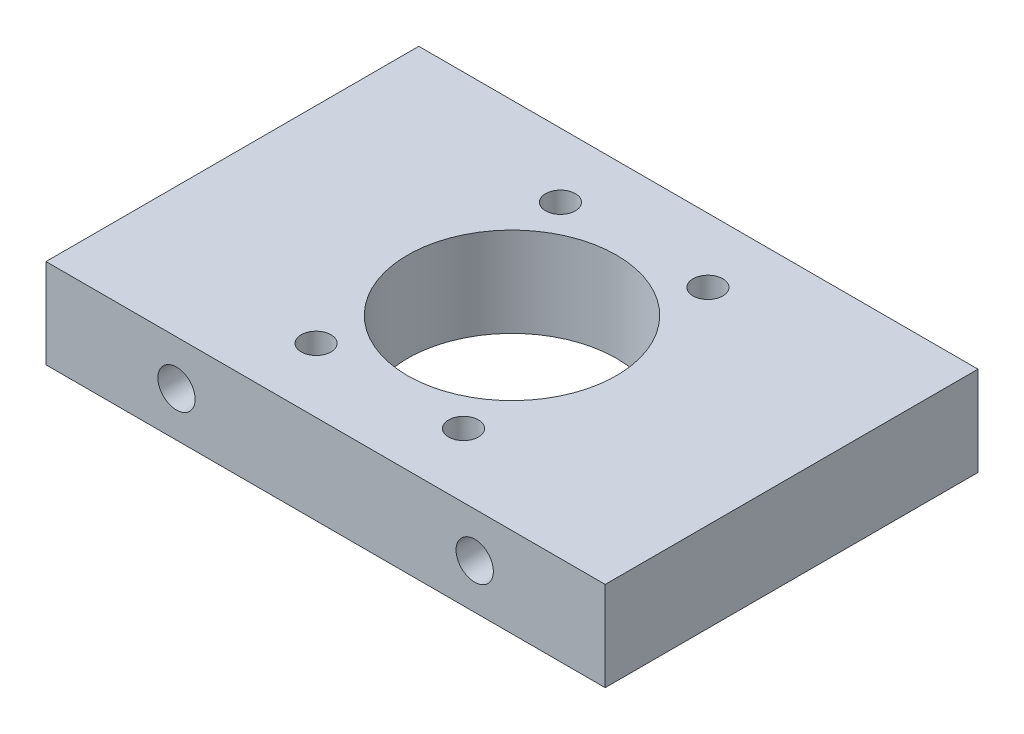
from build123d import *

# Parameters (mm, degrees)
SKETCH1_W           = 75
SKETCH1_H           = 50
BOSS_EXTRUDE1_DEPTH = 12
SKETCH2_R           = 14.01
CUT_EXTRUDE1_DEPTH  = 12
SKETCH9_R           = 2
CUT_EXTRUDE2_DEPTH  = 19


with BuildPart() as part:
    # Sketch1 → Boss-Extrude1 (new body)
    with BuildSketch(Plane(origin=(0, 0, 0), x_dir=(1, 0, 0), z_dir=(0, 1, 0))):
        Rectangle(SKETCH1_W, SKETCH1_H)
    extrude(amount=BOSS_EXTRUDE1_DEPTH)

    # Sketch2 → Cut-Extrude1 (cut)
    with BuildSketch(Plane(origin=(0, 12, 0), x_dir=(1, 0, 0), z_dir=(0, 1, 0))):
        with Locations(Location((0, 0, 0), (0, 0, 270))):
            Circle(SKETCH2_R)
    extrude(amount=-CUT_EXTRUDE1_DEPTH, mode=Mode.SUBTRACT)

    # Sketch9 → Cut-Extrude2 (cut)
    with BuildSketch(Plane.XZ):
        with Locations(Location((-9.886968549, 16.388822862, 0), (0, 0, 270))):
            Circle(SKETCH9_R)
        with Locations(Location((9.886968549, 16.388822862, 0), (0, 0, 90))):
            Circle(SKETCH9_R)
        with Locations(Location((-9.886968549, -16.388822862, 0), (0, 0, 90))):
            Circle(SKETCH9_R)
        with Locations(Location((9.886968549, -16.388822862, 0), (0, 0, 270))):
            Circle(SKETCH9_R)
    extrude(amount=-CUT_EXTRUDE2_DEPTH, mode=Mode.SUBTRACT)

    # Sketch11 → Ø5.0mm Dowel Hole1 (revolve, cut)
    with BuildSketch(Plane(origin=(20, 6, -25), x_dir=(0, 1, 0), z_dir=(1, 0, 0))):
        Polygon((0, 0), (0, 51.502151548), (2.5, 50), (2.5, 0), align=None)
    f_5_0mm_dowel_hole1 = revolve(axis=Axis((20, 6, -31.35), (0, 0, 1)), mode=Mode.SUBTRACT)

    # Mirror1: Ø5.0mm Dowel Hole1 across plane
    add(f_5_0mm_dowel_hole1.mirror(Plane(origin=(0, 0, 0), x_dir=(0, 0, 1), z_dir=(1, 0, 0))), mode=Mode.SUBTRACT)


solid = part.part
